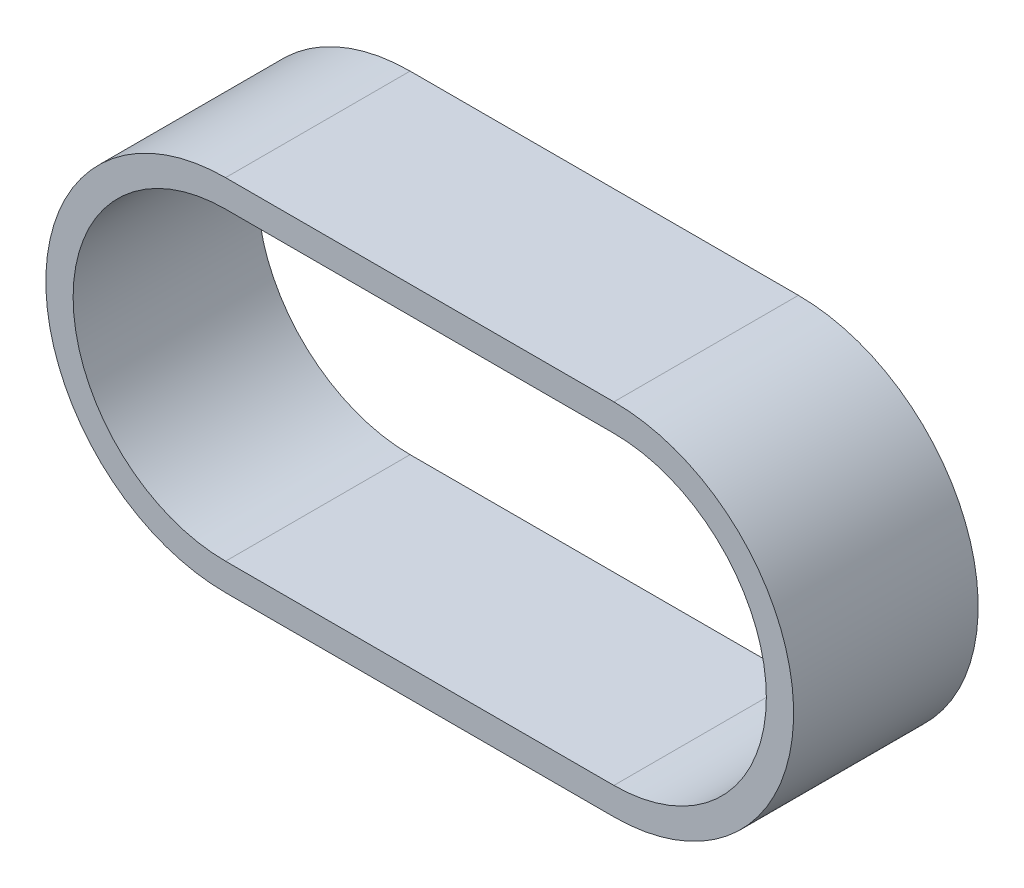
from build123d import *

# Parameters (mm, degrees)
ESTRUSIONE_ESTRUSIONE1_DEPTH = 115


with BuildPart() as part:
    # Schizzo1 → Estrusione-Estrusione1 (new body)
    with BuildSketch(Plane.XY):
        with BuildLine():
            Line((-121, 112), (121, 112))
            ThreePointArc((121, 112), (233, 0), (121, -112))
            Line((121, -112), (-121, -112))
            ThreePointArc((-121, -112), (-233, 0), (-121, 112))
        make_face()
        with BuildLine():
            Line((-121, 95), (121, 95))
            ThreePointArc((121, 95), (216, 0), (121, -95))
            Line((121, -95), (-121, -95))
            ThreePointArc((-121, -95), (-216, 0), (-121, 95))
        make_face(mode=Mode.SUBTRACT)
    extrude(amount=ESTRUSIONE_ESTRUSIONE1_DEPTH)


solid = part.part
